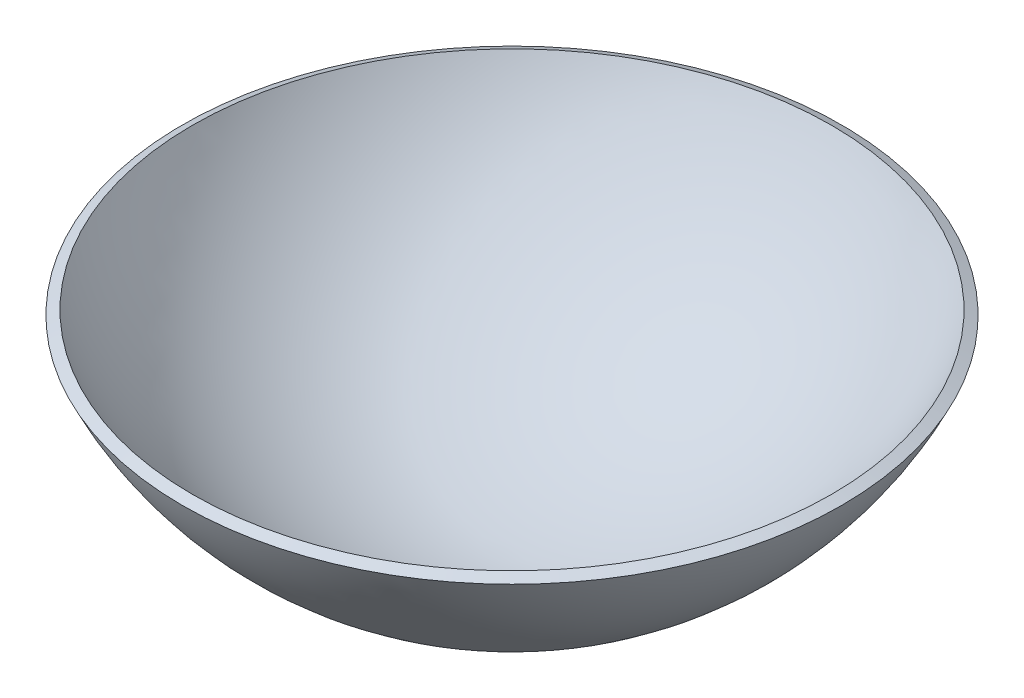
from build123d import *


with BuildPart() as part:
    # Sketch1 → Revolve6 (revolve)
    with BuildSketch(Plane.XY):
        with BuildLine():
            Line((0, -84.077397425), (0, -81.537397425))
            ThreePointArc((0, -81.537397425), (43.810011702, -68.767943502), (73.897978221, -34.459193167))
            Line((73.897978221, -34.459193167), (76.2, -35.532643551))
            ThreePointArc((76.2, -35.532643551), (45.174752707, -70.910157774), (0, -84.077397425))
        make_face()
    revolve(axis=Axis((0, 83.82, 0), (0, -1, 0)))


solid = part.part
